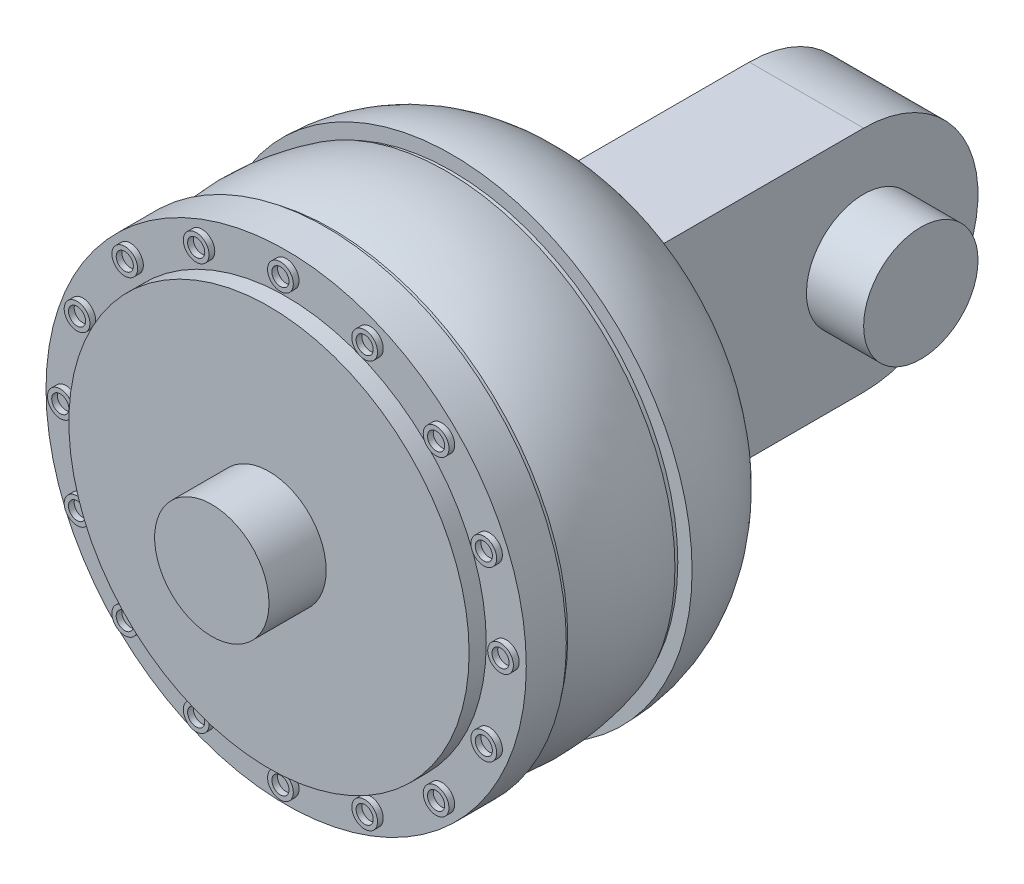
from build123d import *

# Parameters (mm, degrees)
SKETCH2_R            = 39.5
BOSS_EXTRUDE1_DEPTH  = 1
SKETCH4_R            = 41.25
BOSS_EXTRUDE2_DEPTH  = 1
SKETCH5_R            = 42
BOSS_EXTRUDE3_DEPTH  = 7
SKETCH6_R            = 35
BOSS_EXTRUDE4_DEPTH  = 3
BOSS_EXTRUDE5_DEPTH  = 1
CIRPATTERN1_COUNT    = 16
SKETCH8_W            = 20
SKETCH8_H            = 40
BOSS_EXTRUDE6_DEPTH  = 42
SKETCH9_R            = 20
BOSS_EXTRUDE7_DEPTH  = 20
SKETCH11_R           = 10
BOSS_EXTRUDE9_DEPTH  = 10
SKETCH12_R           = 10
BOSS_EXTRUDE10_DEPTH = 10


with BuildPart() as part:
    # Sketch1 → Revolve1 (revolve)
    with BuildSketch(Plane(origin=(0, 0, 0), x_dir=(1, 0, 0), z_dir=(0, 1, 0))):
        with BuildLine():
            Line((-32, 0), (0, 0))
            Line((0, 0), (0, -20))
            Line((0, -20), (-42, -20))
            ThreePointArc((-42, -20), (-39.360679775, -8.819660113), (-32, 0))
        make_face()
    revolve(axis=Axis((0, 0, 0), (0, 0, 1)))

    # Sketch2 → Boss-Extrude1 (add)
    with BuildSketch(Plane.XY.offset(20)):
        Circle(SKETCH2_R)
    extrude(amount=BOSS_EXTRUDE1_DEPTH)

    # Sketch3 → Revolve2 (revolve)
    with BuildSketch(Plane(origin=(0, 0, 0), x_dir=(1, 0, 0), z_dir=(0, 1, 0))):
        with BuildLine():
            Line((0, -21), (-40, -21))
            ThreePointArc((-40, -21), (-41.376973739, -31), (-40, -41))
            Line((-40, -41), (0, -41))
            Line((0, -41), (0, -21))
        make_face()
    revolve(axis=Axis((0, 0, 21), (0, 0, 1)))

    # Sketch4 → Boss-Extrude2 (add)
    with BuildSketch(Plane.XY.offset(41)):
        Circle(SKETCH4_R)
    extrude(amount=BOSS_EXTRUDE2_DEPTH)

    # Sketch5 → Boss-Extrude3 (add)
    with BuildSketch(Plane.XY.offset(42)):
        Circle(SKETCH5_R)
    extrude(amount=BOSS_EXTRUDE3_DEPTH)

    # Sketch6 → Boss-Extrude4 (add)
    with BuildSketch(Plane.XY.offset(49)):
        Circle(SKETCH6_R)
    extrude(amount=BOSS_EXTRUDE4_DEPTH)

    # Sketch7 → Boss-Extrude5 (add)
    with BuildSketch(Plane.XY.offset(49)):
        with BuildLine():
            ThreePointArc((37, 0), (38.5, 1.5), (40, 0))
            Line((40, 0), (40.75, 0))
            ThreePointArc((40.75, 0), (38.5, 2.25), (36.25, 0))
            Line((36.25, 0), (37, 0))
        make_face()
        with BuildLine():
            Line((40.75, 0), (40, 0))
            ThreePointArc((40, 0), (38.5, -1.5), (37, 0))
            Line((37, 0), (36.25, 0))
            ThreePointArc((36.25, 0), (38.5, -2.25), (40.75, 0))
        make_face()
    boss_extrude5 = extrude(amount=BOSS_EXTRUDE5_DEPTH)

    # CirPattern1: Boss-Extrude5 ×16 about axis
    cirpattern1_axis = Axis((0, 0, 0), (0, 0, 1))
    for i in range(1, CIRPATTERN1_COUNT):
        add(boss_extrude5.rotate(cirpattern1_axis, i * 360 / CIRPATTERN1_COUNT))

    # Sketch8 → Boss-Extrude6 (add)
    with BuildSketch(Plane(origin=(0, 0, 0), x_dir=(-1, 0, 0), z_dir=(0, 0, -1))):
        Rectangle(SKETCH8_W, SKETCH8_H)
    extrude(amount=BOSS_EXTRUDE6_DEPTH)

    # Sketch9 → Boss-Extrude7 (add)
    with BuildSketch(Plane.ZY.offset(10)):
        with Locations((-42, 0)):
            Circle(SKETCH9_R)
    extrude(amount=-BOSS_EXTRUDE7_DEPTH)

    # Sketch11 → Boss-Extrude9 (add)
    with BuildSketch(Plane.XY.offset(52)):
        Circle(SKETCH11_R)
    extrude(amount=BOSS_EXTRUDE9_DEPTH)

    # Sketch12 → Boss-Extrude10 (add)
    with BuildSketch(Plane(origin=(10, 0, 0), x_dir=(0, 0, -1), z_dir=(1, 0, 0))):
        with Locations(Location((42, 0, 0), (0, 0, 270))):
            Circle(SKETCH12_R)
    extrude(amount=BOSS_EXTRUDE10_DEPTH)


solid = part.part
